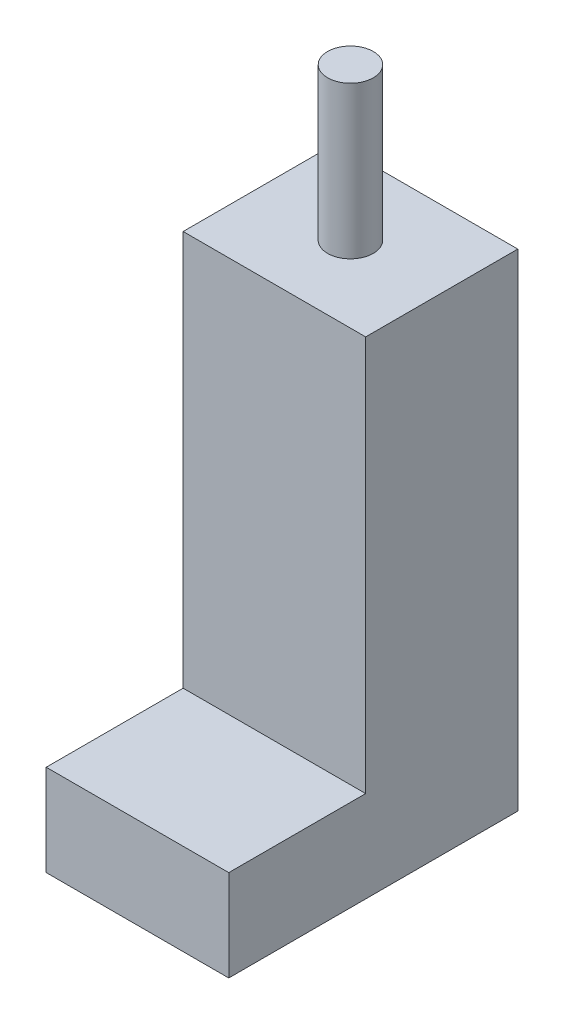
from build123d import *

# Parameters (mm, degrees)
SKETCH_1_W      = 12
SKETCH_1_H      = 10
EXTRUDE_1_DEPTH = 32
SKETCH_2_R      = 1.5
EXTRUDE_2_DEPTH = 10
SKETCH_3_W      = 12
SKETCH_3_H      = 6
EXTRUDE_3_DEPTH = 9


with BuildPart() as part:
    # 草图1 → 凸台-拉伸1 (new body)
    with BuildSketch(Plane(origin=(0, 0, 0), x_dir=(1, 0, 0), z_dir=(0, 1, 0))):
        Rectangle(SKETCH_1_W, SKETCH_1_H)
    extrude(amount=EXTRUDE_1_DEPTH)

    # 草图2 → 凸台-拉伸2 (add)
    with BuildSketch(Plane(origin=(0, 32, 0), x_dir=(1, 0, 0), z_dir=(0, 1, 0))):
        with Locations(Location((0, 0, 0), (0, 0, 270))):
            Circle(SKETCH_2_R)
    extrude(amount=EXTRUDE_2_DEPTH)

    # 草图3 → 凸台-拉伸3 (add)
    with BuildSketch(Plane.XY.offset(5)):
        with Locations((0, 3)):
            Rectangle(SKETCH_3_W, SKETCH_3_H)
    extrude(amount=EXTRUDE_3_DEPTH)


solid = part.part
